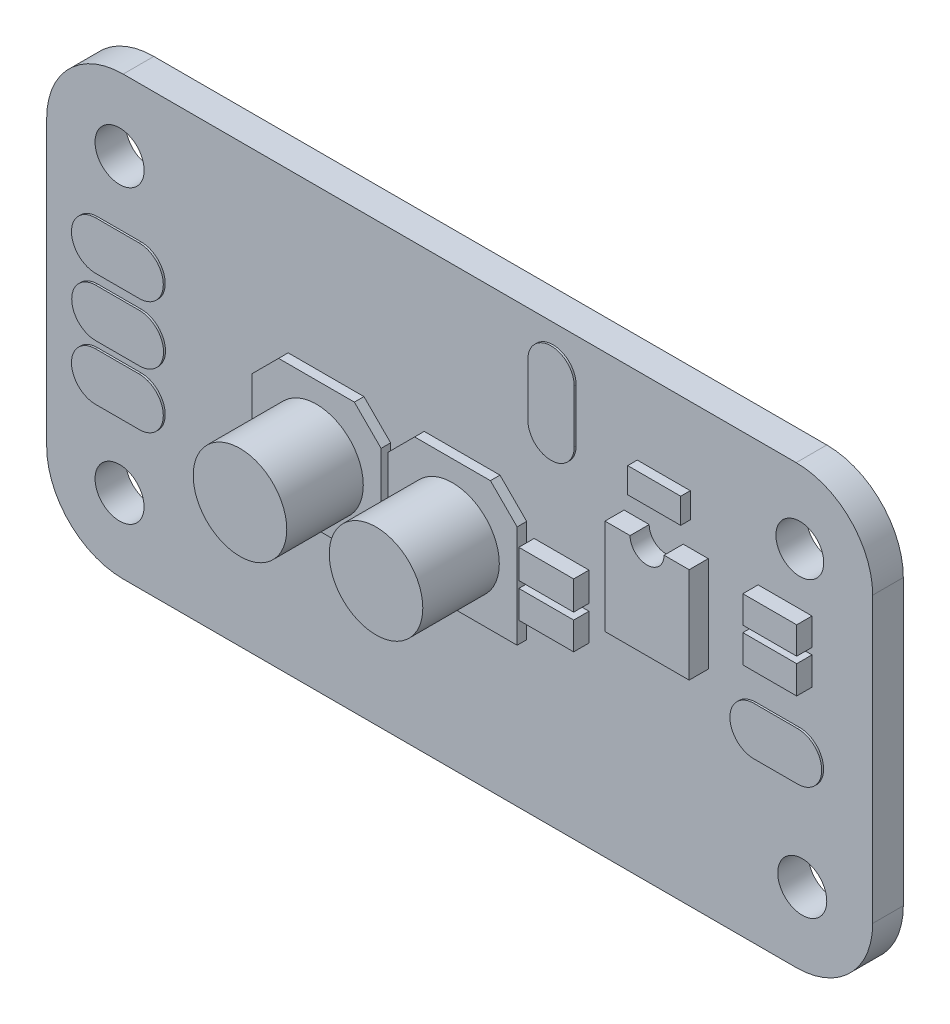
from build123d import *

# Parameters (mm, degrees)
SKETCH_2_W          = 43.1785014
SKETCH_2_H          = 22.86
EXTRUDE_1_DEPTH     = 1.6
SKETCH_3_R          = 1.283879863
SKETCH_3_R_2        = 1.281760523
SKETCH_3_R_3        = 1.2500102
CUT_EXTRUDE_1_DEPTH = 1.6
EXTRUDE_2_DEPTH     = 1
EXTRUDE_3_DEPTH     = 0.5
SKETCH_6_R          = 2.445789306
EXTRUDE_4_DEPTH     = 4
EXTRUDE_5_DEPTH     = 0.1
SKETCH_9_W          = 2.815880296
SKETCH_9_H          = 1.422027446
SKETCH_9_H_2        = 1.462665737
SKETCH_9_W_2        = 2.865727124
SKETCH_9_H_3        = 1.505721031
SKETCH_9_H_4        = 1.440958836
EXTRUDE_6_DEPTH     = 0.8
SKETCH_10_W         = 2.7701748
SKETCH_10_H         = 1.3212064
EXTRUDE_7_DEPTH     = 0.5
FILLET_1_R          = 4


with BuildPart() as part:
    # 草图2 → 凸台-拉伸1 (new body)
    with BuildSketch(Plane.XY):
        with Locations((20.3207493, 10.16)):
            Rectangle(SKETCH_2_W, SKETCH_2_H)
    extrude(amount=EXTRUDE_1_DEPTH)

    # 草图3 → 切除-拉伸1 (cut)
    with BuildSketch(Plane.XY.offset(1.6)):
        with Locations((2.5414986, 17.7785014)):
            Circle(SKETCH_3_R)
        with Locations((2.54, 2.54)):
            Circle(SKETCH_3_R_2)
        with Locations((38.227, 2.54)):
            Circle(SKETCH_3_R_2)
        with Locations((38.1, 17.78)):
            Circle(SKETCH_3_R_3)
    extrude(amount=-CUT_EXTRUDE_1_DEPTH, mode=Mode.SUBTRACT)

    # 草图4 → 凸台-拉伸2 (add)
    with BuildSketch(Plane.XY.offset(1.6)):
        with BuildLine():
            Line((32.004, 14.945995), (33.3149956, 14.945995))
            Line((33.3149956, 14.945995), (33.3149956, 9.946005))
            Line((33.3149956, 9.946005), (28.9150044, 9.946005))
            Line((28.9150044, 9.946005), (28.9150044, 14.945995))
            Line((28.9150044, 14.945995), (30.226, 14.945995))
            ThreePointArc((30.226, 14.945995), (31.115, 14.056677443), (32.004, 14.945995))
        make_face()
    extrude(amount=EXTRUDE_2_DEPTH)

    # 草图5 → 凸台-拉伸3 (add)
    with BuildSketch(Plane.XY.offset(1.6)):
        Polygon((11.3538, 13.28166), (9.95934, 11.8872), (9.95934, 6.53034), (16.711168, 6.529832), (16.711168, 11.8860316), (15.3150316, 13.282168), align=None)
        Polygon((18.4658, 13.28166), (17.07134, 11.8872), (17.07134, 6.53034), (23.823168, 6.529832), (23.823168, 11.8860316), (22.4270316, 13.282168), align=None)
    extrude(amount=EXTRUDE_3_DEPTH)

    # 草图6 → 凸台-拉伸4 (add)
    with BuildSketch(Plane.XY.offset(2.1)):
        with Locations((13.335, 9.752040279)):
            Circle(SKETCH_6_R)
        with Locations((20.4464158, 9.752040279)):
            Circle(SKETCH_6_R)
    extrude(amount=EXTRUDE_4_DEPTH)

    # 草图7 → 凸台-拉伸5 (add)
    with BuildSketch(Plane.XY.offset(1.6)):
        with BuildLine():
            Line((1.397, 11.417275077), (3.683, 11.417275077))
            ThreePointArc((3.683, 11.417275077), (4.940275077, 10.16), (3.683, 8.902724923))
            Line((3.683, 8.902724923), (1.397, 8.902724923))
            ThreePointArc((1.397, 8.902724923), (0.139724923, 10.16), (1.397, 11.417275077))
        make_face()
        with BuildLine():
            Line((1.384057208, 14.463336619), (3.670057208, 14.463336619))
            ThreePointArc((3.670057208, 14.463336619), (4.927332285, 13.206061542), (3.670057208, 11.948786466))
            Line((3.670057208, 11.948786466), (1.384057208, 11.948786466))
            ThreePointArc((1.384057208, 11.948786466), (0.126782131, 13.206061542), (1.384057208, 14.463336619))
        make_face()
        with BuildLine():
            Line((1.384057208, 8.530334061), (3.670057208, 8.530334061))
            ThreePointArc((3.670057208, 8.530334061), (4.927332285, 7.273058984), (3.670057208, 6.015783908))
            Line((3.670057208, 6.015783908), (1.384057208, 6.015783908))
            ThreePointArc((1.384057208, 6.015783908), (0.126782131, 7.273058984), (1.384057208, 8.530334061))
        make_face()
        with BuildLine():
            Line((35.801623871, 9.688824593), (38.087623871, 9.688824593))
            ThreePointArc((38.087623871, 9.688824593), (39.344898948, 8.431549516), (38.087623871, 7.17427444))
            Line((38.087623871, 7.17427444), (35.801623871, 7.17427444))
            ThreePointArc((35.801623871, 7.17427444), (34.544348794, 8.431549516), (35.801623871, 9.688824593))
        make_face()
        with BuildLine():
            Line((26.408339557, 19.359447221), (26.408339557, 16.596292633))
            ThreePointArc((26.408339557, 16.596292633), (25.197327361, 15.385280436), (23.986315165, 16.596292633))
            Line((23.986315165, 16.596292633), (23.986315165, 19.359447221))
            ThreePointArc((23.986315165, 19.359447221), (25.197327361, 20.570459417), (26.408339557, 19.359447221))
        make_face()
    extrude(amount=EXTRUDE_5_DEPTH)

    # 草图9 → 凸台-拉伸6 (add)
    with BuildSketch(Plane.XY.offset(1.6)):
        with Locations((37.32890041, 14.350017877)):
            Rectangle(SKETCH_9_W, SKETCH_9_H)
        with Locations((37.32890041, 12.569367647)):
            Rectangle(SKETCH_9_W, SKETCH_9_H_2)
        with Locations((25.644961239, 10.555802193)):
            Rectangle(SKETCH_9_W_2, SKETCH_9_H_3)
        with Locations((25.644961239, 8.726270188)):
            Rectangle(SKETCH_9_W_2, SKETCH_9_H_4)
    extrude(amount=EXTRUDE_6_DEPTH)

    # 草图10 → 凸台-拉伸7 (add)
    with BuildSketch(Plane.XY.offset(1.6)):
        with Locations((30.988, 16.891)):
            Rectangle(SKETCH_10_W, SKETCH_10_H)
    extrude(amount=EXTRUDE_7_DEPTH)

    # 圆角1
    fillet_1_edges = [part.edges().sort_by_distance(p)[0] for p in [
        (-1.2685014, 21.59, 0.8),
        (41.91, 21.59, 0.8),
        (41.91, -1.27, 0.8),
        (-1.2685014, -1.27, 0.8),
    ]]
    fillet(fillet_1_edges, radius=FILLET_1_R)


solid = part.part
